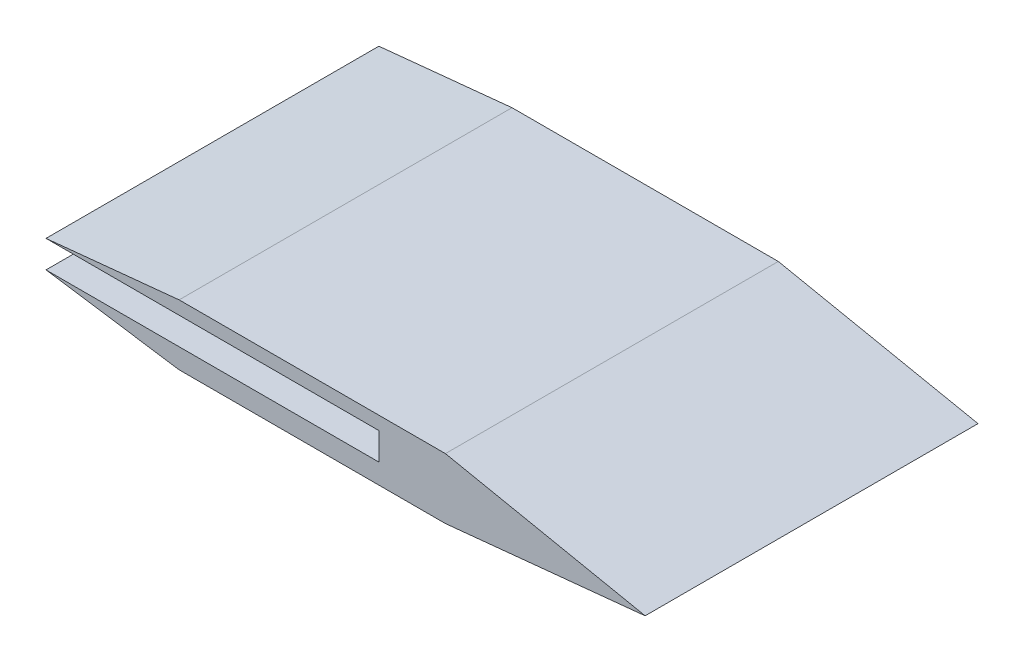
from build123d import *

# Parameters (mm, degrees)
P_IDAT_VYSUNUT_M1_DEPTH = 50


with BuildPart() as part:
    # Skica1 → Přidat vysunutím1 (new body)
    with BuildSketch(Plane.XY):
        Polygon((0, 0), (20, 2), (60, 2), (90, -4.1), (60, -7.1), (20, -7.1), (0, -4.1), (50, -4.1), (50, 0), align=None)
    extrude(amount=P_IDAT_VYSUNUT_M1_DEPTH)


solid = part.part
